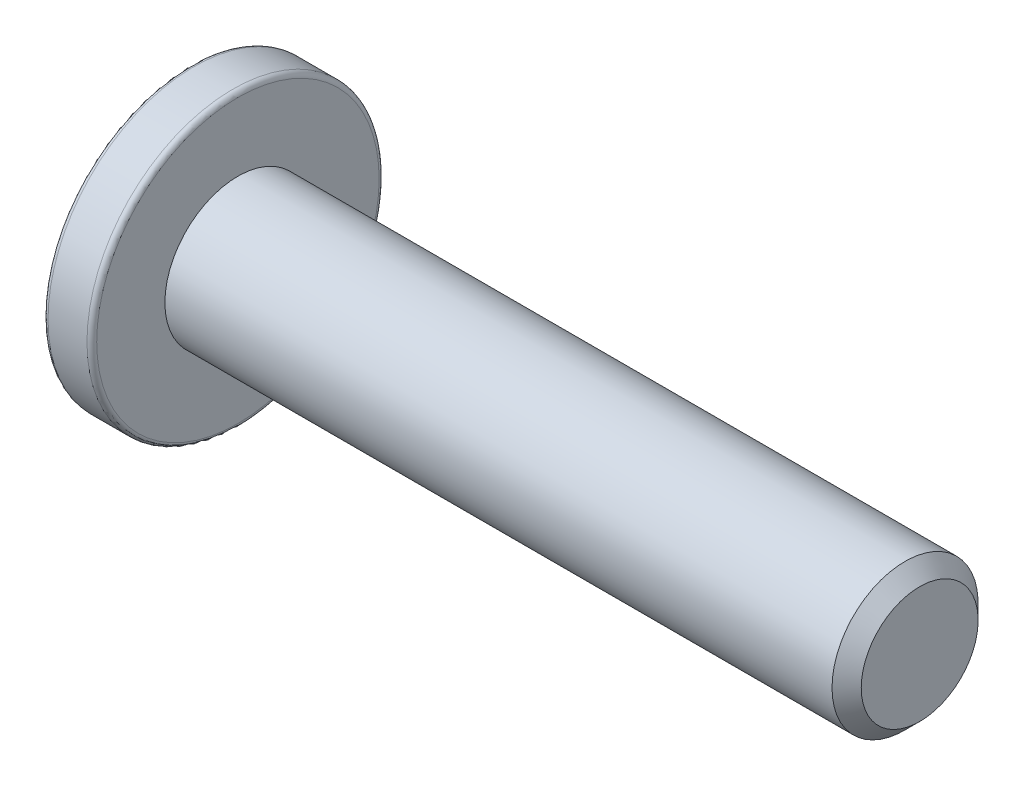
from build123d import *

# Parameters (mm, degrees)
CUT_EXTRUDE_1_DEPTH = 0.5


with BuildPart() as part:
    # 草图1 → 旋转1 (revolve)
    with BuildSketch(Plane.XY, mode=Mode.PRIVATE) as revolve_1_sk:
        Polygon((14, 1.2), (13.7, 1.5), (0, 1.5), (0, 0), (14, 0), align=None)
        with BuildLine():
            Line((-0.1, 3), (-0.9, 3))
            ThreePointArc((-0.9, 3), (-0.970710678, 2.970710678), (-1, 2.9))
            Line((-1, 2.9), (-1, 0))
            Line((-1, 0), (0, 0))
            Line((0, 0), (0, 2.9))
            ThreePointArc((0, 2.9), (-0.029289322, 2.970710678), (-0.1, 3))
        make_face()
    revolve(revolve_1_sk.sketch.rotate(Axis((0, 0, 0), (1, 0, 0)), 90), axis=Axis((0, 0, 0), (1, 0, 0)))

    # 草图2 → 切除-拉伸1 (cut)
    with BuildSketch(Plane.ZY.offset(1)):
        Polygon((1, -0.577350269), (1, 0.577350269), (0, 1.154700538), (-1, 0.577350269), (-1, -0.577350269), (0, -1.154700538), align=None)
    extrude(amount=-CUT_EXTRUDE_1_DEPTH, mode=Mode.SUBTRACT)


solid = part.part
